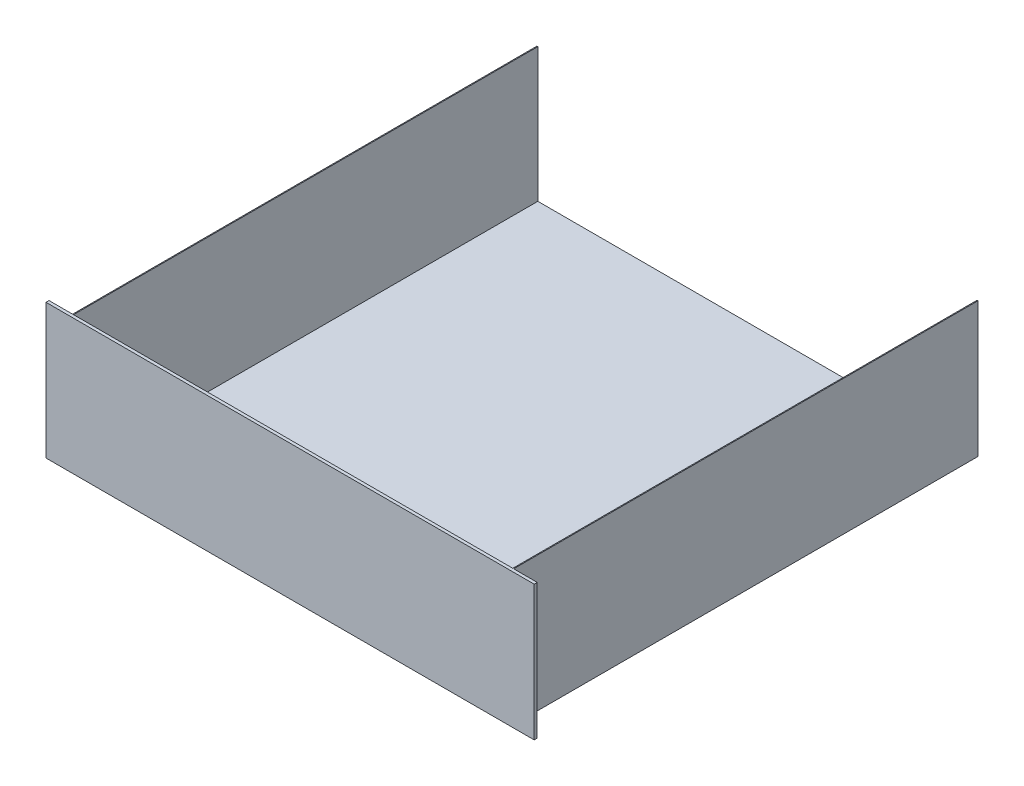
from build123d import *

# Parameters (mm, degrees)
SKETCH1_W           = 482.6
SKETCH1_H           = 133.35
FRONT_PANEL_DEPTH   = 3
BOSS_EXTRUDE2_DEPTH = 459


with BuildPart() as part:
    # Sketch1 → Front panel (new body)
    with BuildSketch(Plane.XY):
        Rectangle(SKETCH1_W, SKETCH1_H)
    extrude(amount=FRONT_PANEL_DEPTH)

    # Sketch2 → Boss-Extrude2 (add)
    with BuildSketch(Plane(origin=(0, 0, 0), x_dir=(-1, 0, 0), z_dir=(0, 0, -1))):
        Polygon((-218, 66.675), (-218, -66.675), (218, -66.675), (218, 66.675), (217.1, 66.675), (217.1, -65.775), (-217.1, -65.775), (-217.1, 66.675), align=None)
    extrude(amount=BOSS_EXTRUDE2_DEPTH)


solid = part.part
